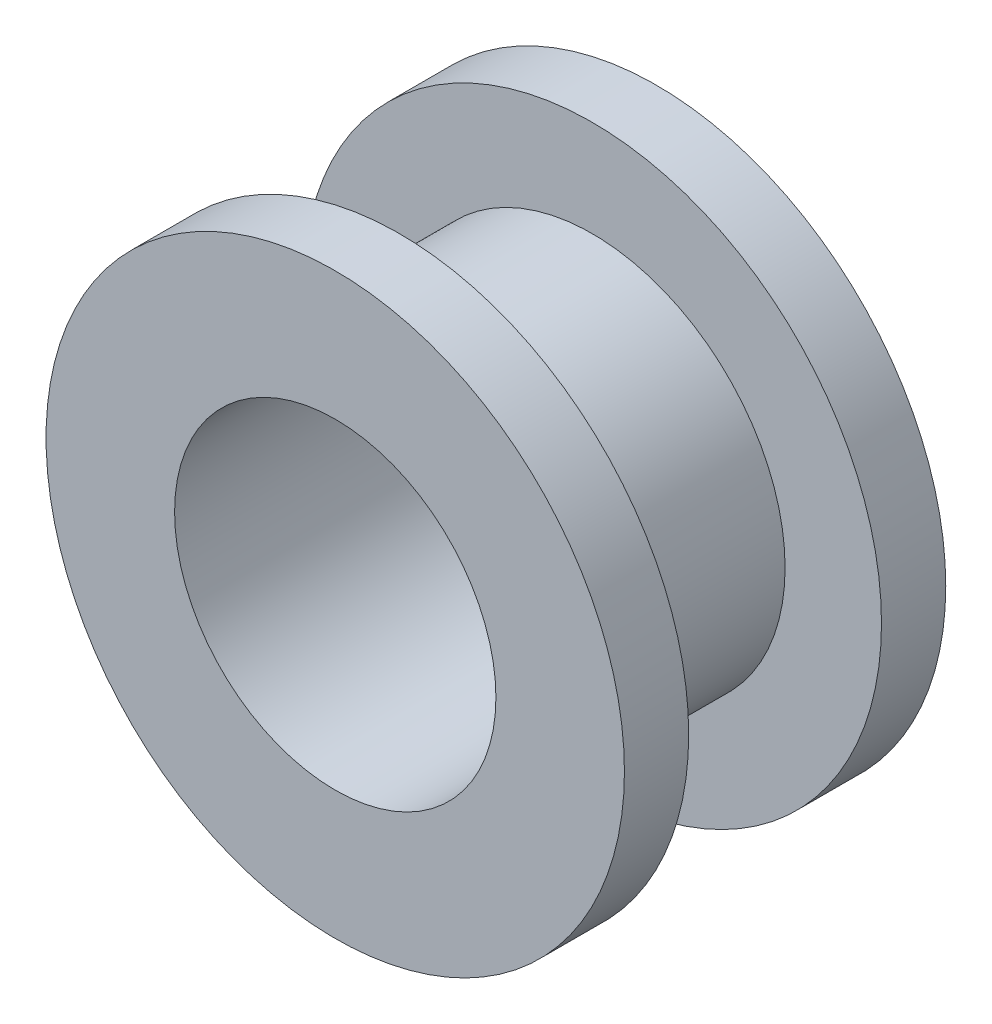
from build123d import *

# Parameters (mm, degrees)
SKETCH_1_R      = 9
SKETCH_1_R_2    = 5
EXTRUDE_1_DEPTH = 2
SKETCH_2_R      = 6
SKETCH_2_R_2    = 5
EXTRUDE_2_DEPTH = 8
EXTRUDE_START   = -2
SKETCH_3_R      = 9
SKETCH_3_R_2    = 5
EXTRUDE_3_DEPTH = 2


with BuildPart() as part:
    # 草图1 → 凸台-拉伸1 (new body)
    with BuildSketch(Plane.XY):
        with Locations((0, 118.25)):
            Circle(SKETCH_1_R)
        with Locations((0, 118.25)):
            Circle(SKETCH_1_R_2, mode=Mode.SUBTRACT)
    extrude(amount=EXTRUDE_1_DEPTH)

    # 草图2 → 凸台-拉伸2 (add)
    with BuildSketch(Plane.XY.offset(2)):
        with Locations(Location((0, 118.25, 0), (0, 0, 180))):
            Circle(SKETCH_2_R)
        with Locations(Location((0, 118.25, 0), (0, 0, 180))):
            Circle(SKETCH_2_R_2, mode=Mode.SUBTRACT)
    extrude(amount=EXTRUDE_2_DEPTH)

    # 草图3 → 凸台-拉伸3 (add)
    with BuildSketch(Plane.XY.offset(10).offset(EXTRUDE_START)):
        with Locations((0, 118.25)):
            Circle(SKETCH_3_R)
        with Locations(Location((0, 118.25, 0), (0, 0, 180))):
            Circle(SKETCH_3_R_2, mode=Mode.SUBTRACT)
    extrude(amount=EXTRUDE_3_DEPTH)


solid = part.part
